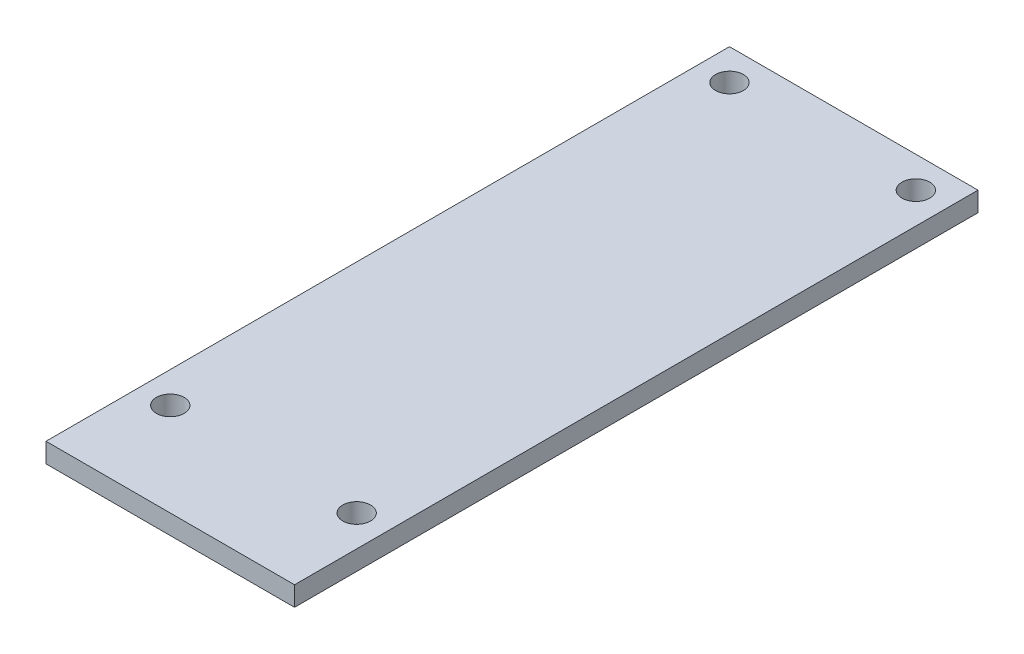
from build123d import *

# Parameters (mm, degrees)
SKETCH1_W           = 25.4
SKETCH1_H           = 69.85
BOSS_EXTRUDE1_DEPTH = 2
SKETCH2_R           = 1.4224
CUT_EXTRUDE1_DEPTH  = 2


with BuildPart() as part:
    # Sketch1 → Boss-Extrude1 (new body)
    with BuildSketch(Plane(origin=(0, 0, 0), x_dir=(1, 0, 0), z_dir=(0, 1, 0))):
        with Locations((12.7, 34.925)):
            Rectangle(SKETCH1_W, SKETCH1_H)
    extrude(amount=BOSS_EXTRUDE1_DEPTH)

    # Sketch2 → Cut-Extrude1 (cut)
    with BuildSketch(Plane(origin=(0, 2, 0), x_dir=(1, 0, 0), z_dir=(0, 1, 0))):
        with Locations(Location((3.175, 66.675, 0), (0, 0, 270))):
            Circle(SKETCH2_R)
        with Locations(Location((22.225, 66.675, 0), (0, 0, 270))):
            Circle(SKETCH2_R)
        with Locations(Location((3.175, 9.525, 0), (0, 0, 270))):
            Circle(SKETCH2_R)
        with Locations(Location((22.225, 9.525, 0), (0, 0, 270))):
            Circle(SKETCH2_R)
    extrude(amount=-CUT_EXTRUDE1_DEPTH, mode=Mode.SUBTRACT)


solid = part.part
